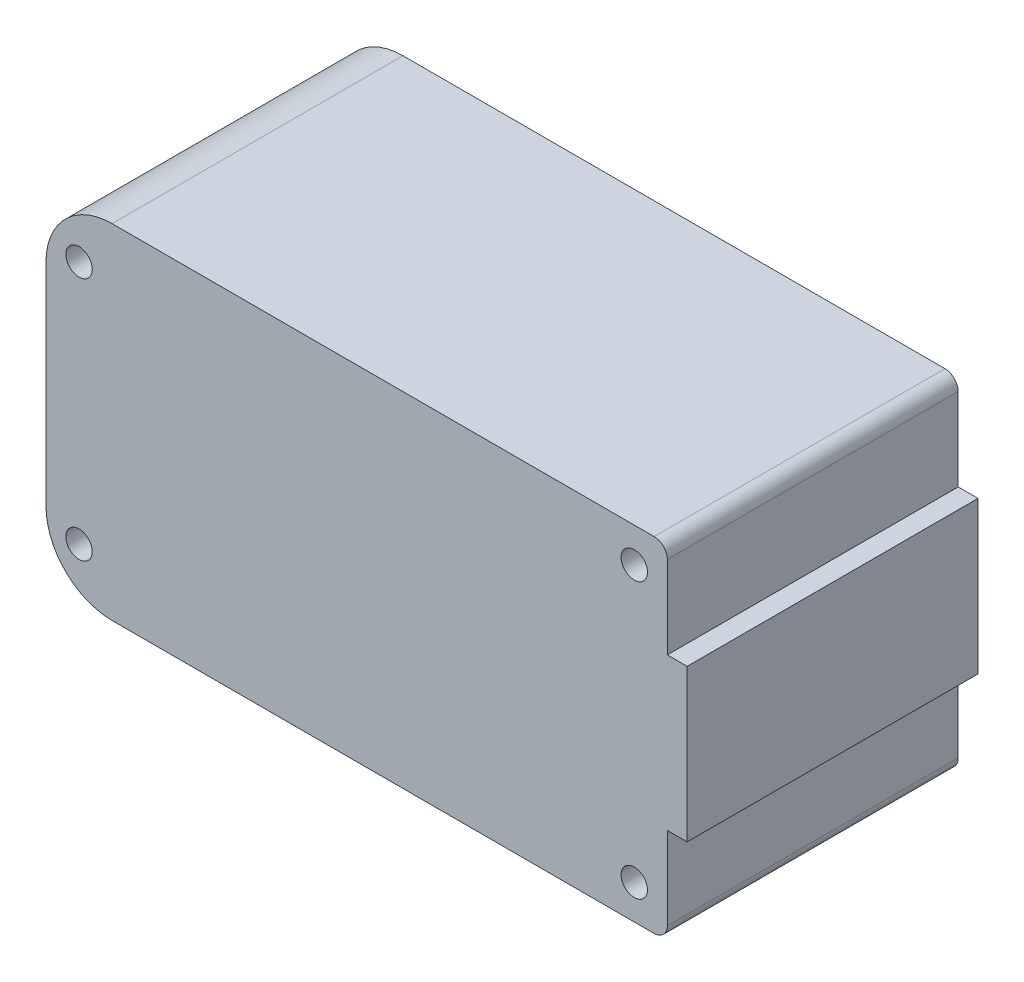
from build123d import *

# Parameters (mm, degrees)
SKETCH1_R           = 1
BOSS_EXTRUDE1_DEPTH = 11
FILLET1_R           = 5
FILLET2_R           = 1


with BuildPart() as part:
    # Sketch1 → Boss-Extrude1 (new, symmetric)
    with BuildSketch(Plane.XY):
        Polygon((35.5, -13), (-11.5, -13), (-11.5, 13), (35.5, 13), (35.5, 5.75), (37, 5.75), (37, -5.75), (35.5, -5.75), align=None)
        with Locations((-9, 9.25)):
            Circle(SKETCH1_R, mode=Mode.SUBTRACT)
        with Locations((33, 10.4)):
            Circle(SKETCH1_R, mode=Mode.SUBTRACT)
        with Locations(Location((33, -10.4, 0), (0, 0, 180))):
            Circle(SKETCH1_R, mode=Mode.SUBTRACT)
        with Locations(Location((-9, -9.25, 0), (0, 0, 180))):
            Circle(SKETCH1_R, mode=Mode.SUBTRACT)
    extrude(amount=BOSS_EXTRUDE1_DEPTH, both=True)

    # Fillet1
    fillet1_edges = [part.edges().sort_by_distance(p)[0] for p in [
        (-11.5, 13, 0),
        (-11.5, -13, 0),
    ]]
    fillet(fillet1_edges, radius=FILLET1_R)

    # Fillet2
    fillet2_edges = [part.edges().sort_by_distance(p)[0] for p in [
        (35.5, 13, 0),
        (35.5, -13, 0),
    ]]
    fillet(fillet2_edges, radius=FILLET2_R)


solid = part.part
